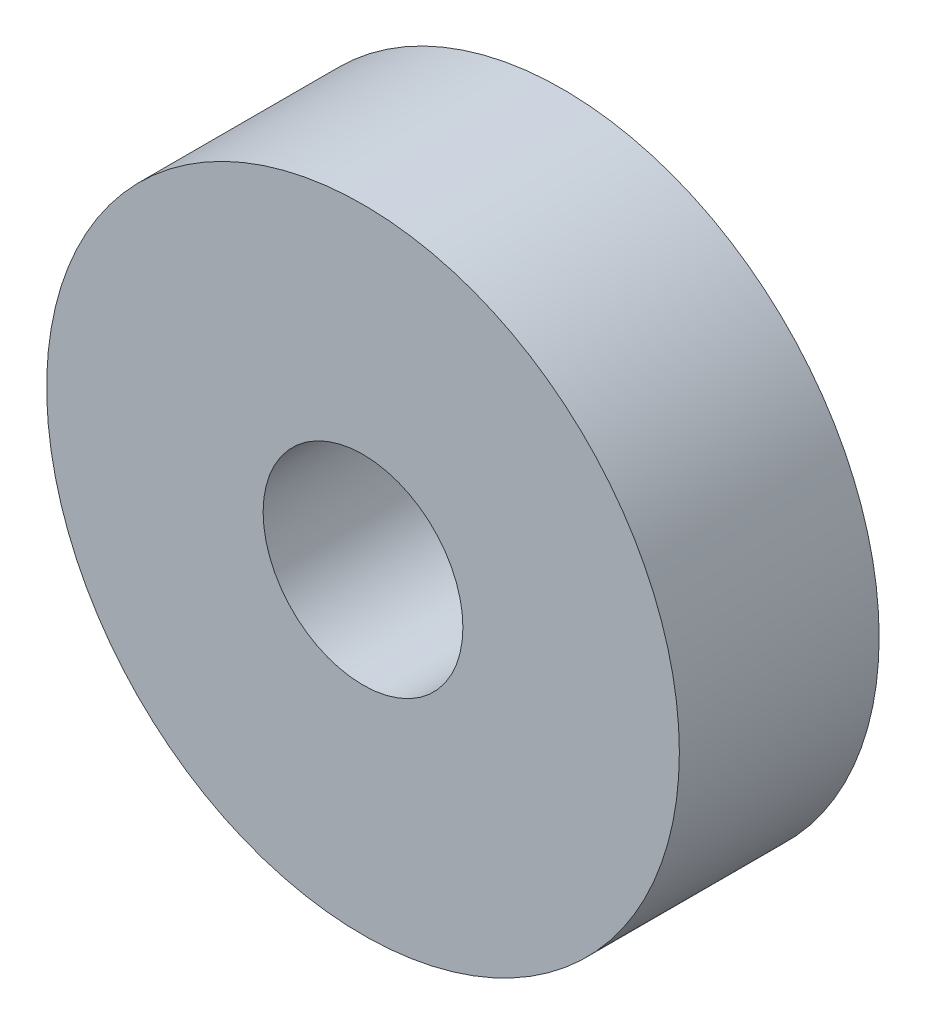
from build123d import *

# Parameters (mm, degrees)
SKETCH_1_R      = 9.5
SKETCH_1_R_2    = 3
EXTRUDE_1_DEPTH = 6


with BuildPart() as part:
    # ｽｹｯﾁ1 → ﾎﾞｽ - 押し出し1 (new body)
    with BuildSketch(Plane.XY):
        Circle(SKETCH_1_R)
        Circle(SKETCH_1_R_2, mode=Mode.SUBTRACT)
    extrude(amount=EXTRUDE_1_DEPTH)


solid = part.part
